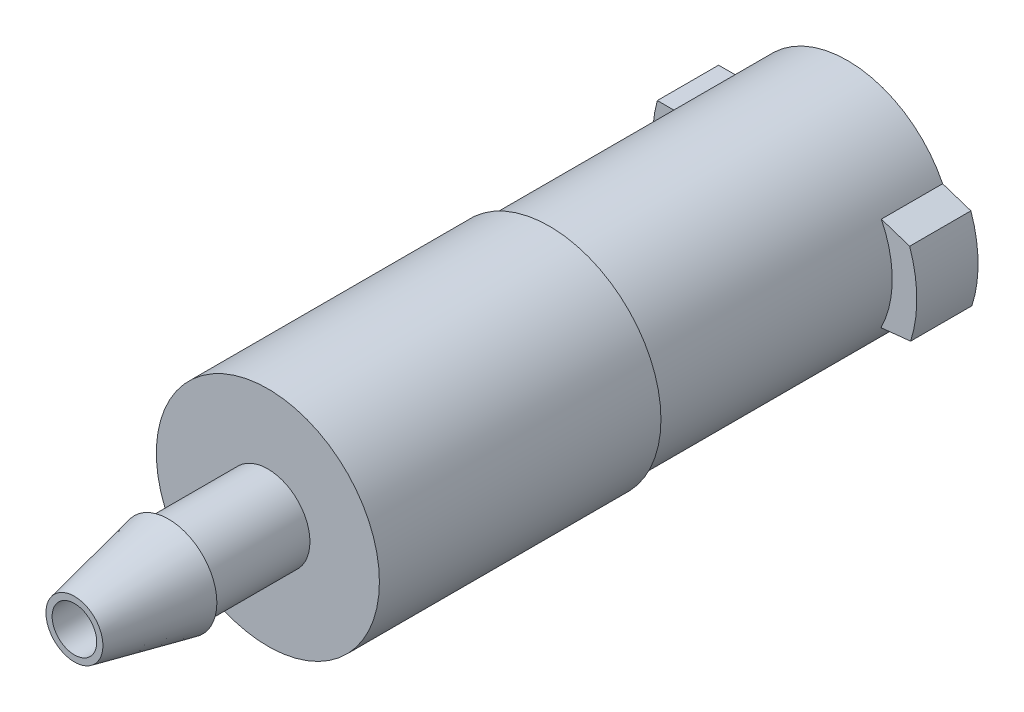
from build123d import *

# Parameters (mm, degrees)
SKETCH1_R           = 3.2
BOSS_EXTRUDE1_DEPTH = 9
SKETCH1_371_R       = 2.145
CUT_EXTRUDE7_DEPTH  = 9
SKETCH2_R           = 3.367447595
SKETCH2_R_2         = 1.27
BOSS_EXTRUDE3_DEPTH = 8.5
BOSS_EXTRUDE4_DEPTH = 1.85
SKETCH7_R           = 1.27
SKETCH7_R_2         = 1
BOSS_EXTRUDE5_DEPTH = 3
SKETCH9_R           = 1.46
SKETCH10_R          = 0.86
SKETCH11_R          = 0.673532446
CUT_EXTRUDE8_DEPTH  = 10


with BuildPart() as part:
    # Sketch1 → Boss-Extrude1 (new body)
    with BuildSketch(Plane.XY):
        Circle(SKETCH1_R)
    extrude(amount=BOSS_EXTRUDE1_DEPTH)

    # Sketch1<371> → Cut-Extrude7 (cut)
    with BuildSketch(Plane.XY):
        Circle(SKETCH1_371_R)
    extrude(amount=CUT_EXTRUDE7_DEPTH, mode=Mode.SUBTRACT)

    # Sketch2 → Boss-Extrude3 (add)
    with BuildSketch(Plane.XY.offset(9)):
        Circle(SKETCH2_R)
        Circle(SKETCH2_R_2, mode=Mode.SUBTRACT)
    extrude(amount=BOSS_EXTRUDE3_DEPTH)

    # Sketch1<372> → Boss-Extrude4 (add)
    with BuildSketch(Plane.XY):
        with BuildLine():
            ThreePointArc((-2.861318951, -1.432778371), (-3.195747329, -0.164921217), (-2.993607202, 1.130626341))
            Line((-2.993607202, 1.130626341), (-3.892248535, 1.130626341))
            ThreePointArc((-3.892248535, 1.130626341), (-4.027565176, -0.120880773), (-3.756146306, -1.350072559))
            Line((-3.756146306, -1.350072559), (-2.861318951, -1.432778371))
        make_face()
        with BuildLine():
            Line((3.72513828, 1.130626341), (2.871661811, 1.411934292))
            ThreePointArc((2.871661811, 1.411934292), (3.116834756, 0.724804183), (3.2, 0))
            ThreePointArc((3.2, 0), (3.114178916, -0.736131563), (2.861318951, -1.432778371))
            Line((2.861318951, -1.432778371), (3.754952726, -1.3380423))
            ThreePointArc((3.754952726, -1.3380423), (3.94108837, -0.101279958), (3.72513828, 1.130626341))
        make_face()
    extrude(amount=BOSS_EXTRUDE4_DEPTH)


with BuildPart() as body_2:
    # Sketch7 → Boss-Extrude5 (new body)
    with BuildSketch(Plane.XY.offset(17.5)):
        Circle(SKETCH7_R)
        Circle(SKETCH7_R_2, mode=Mode.SUBTRACT)
    extrude(amount=BOSS_EXTRUDE5_DEPTH)

    # Sketch9 → Loft1 section 0
    with BuildSketch(Plane.XY.offset(20.5)):
        Circle(SKETCH9_R)
    # Sketch10 → Loft1 section 1
    with BuildSketch(Plane.XY.offset(23.34)):
        Circle(SKETCH10_R)
    loft()

    # Sketch11 → Cut-Extrude8 (cut)
    with BuildSketch(Plane.XY.offset(23.34)):
        Circle(SKETCH11_R)
    extrude(amount=-CUT_EXTRUDE8_DEPTH, mode=Mode.SUBTRACT)


solid = Compound([part.part, body_2.part])
